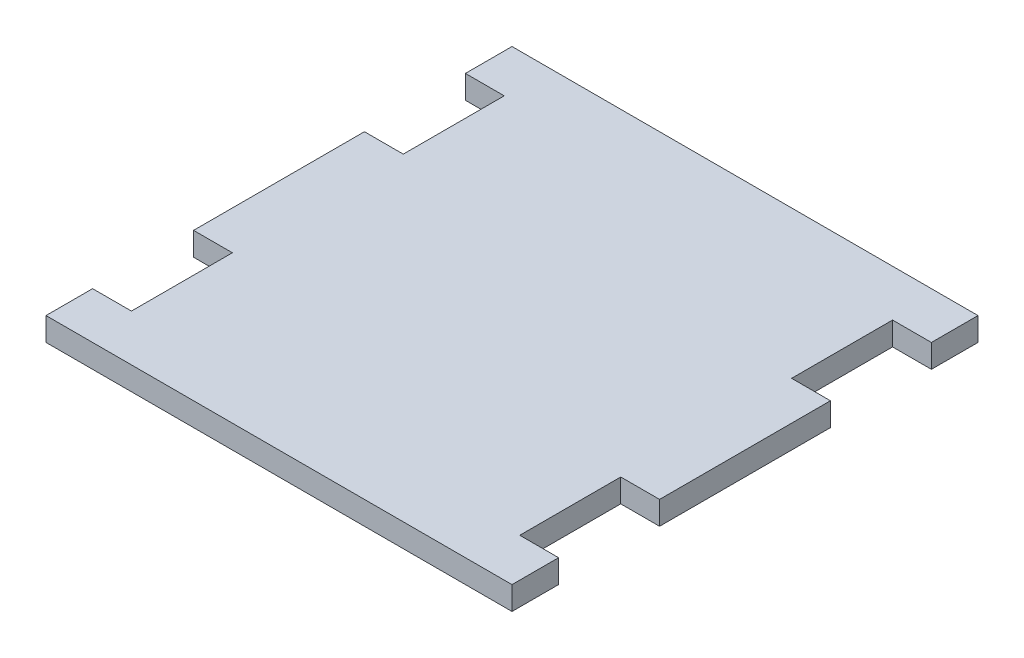
from build123d import *

# Parameters (mm, degrees)
SKETCH1_W           = 300
SKETCH1_H           = 300
BOSS_EXTRUDE1_DEPTH = 15
SKETCH2_W           = 25
SKETCH2_H           = 65
CUT_EXTRUDE1_DEPTH  = 125


with BuildPart() as part:
    # Sketch1 → Boss-Extrude1 (new body)
    with BuildSketch(Plane(origin=(0, 0, 0), x_dir=(1, 0, 0), z_dir=(0, 1, 0))):
        Rectangle(SKETCH1_W, SKETCH1_H)
    extrude(amount=BOSS_EXTRUDE1_DEPTH)

    # Sketch2 → Cut-Extrude1 (cut)
    with BuildSketch(Plane(origin=(0, 15, 0), x_dir=(1, 0, 0), z_dir=(0, 1, 0))):
        with Locations((-137.5, 87.5)):
            Rectangle(SKETCH2_W, SKETCH2_H)
        with Locations((137.5, 87.5)):
            Rectangle(SKETCH2_W, SKETCH2_H)
        with Locations((-137.5, -87.5)):
            Rectangle(SKETCH2_W, SKETCH2_H)
        with Locations((137.5, -87.5)):
            Rectangle(SKETCH2_W, SKETCH2_H)
    extrude(amount=-CUT_EXTRUDE1_DEPTH, mode=Mode.SUBTRACT)


solid = part.part
